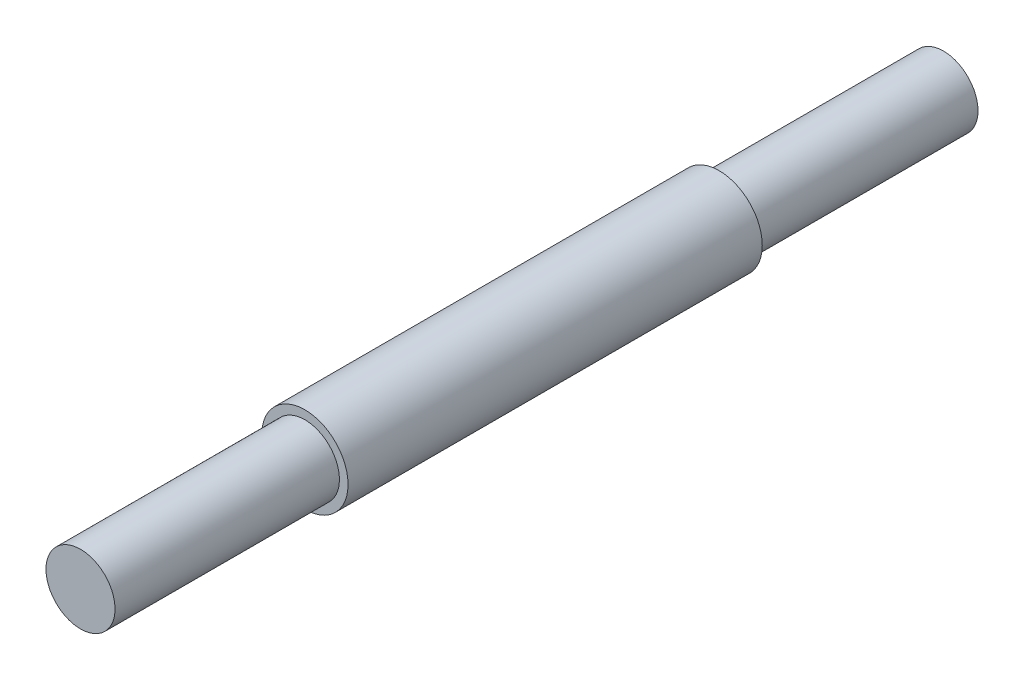
from build123d import *

# Parameters (mm, degrees)
ESQUISSE1_R        = 2.5
BOSS_EXTRU_1_DEPTH = 24
ESQUISSE2_R        = 2
BOSS_EXTRU_2_DEPTH = 13
BOSS_EXTRU_3_START = 13
ESQUISSE3_R        = 2
BOSS_EXTRU_3_DEPTH = 13


with BuildPart() as part:
    # Esquisse1 → Boss.-Extru.1 (new body)
    with BuildSketch(Plane.XY):
        Circle(ESQUISSE1_R)
    extrude(amount=-BOSS_EXTRU_1_DEPTH)

    # Esquisse2 → Boss.-Extru.2 (add)
    with BuildSketch(Plane.XY):
        with Locations(Location((0, 0, 0), (0, 0, 180))):
            Circle(ESQUISSE2_R)
    extrude(amount=BOSS_EXTRU_2_DEPTH)

    # Esquisse3 → Boss.-Extru.3 (add)
    with BuildSketch(Plane(origin=(0, 0, -24), x_dir=(-1, 0, 0), z_dir=(0, 0, -1)).offset(BOSS_EXTRU_3_START)):
        Circle(ESQUISSE3_R)
    extrude(amount=-BOSS_EXTRU_3_DEPTH)


solid = part.part
